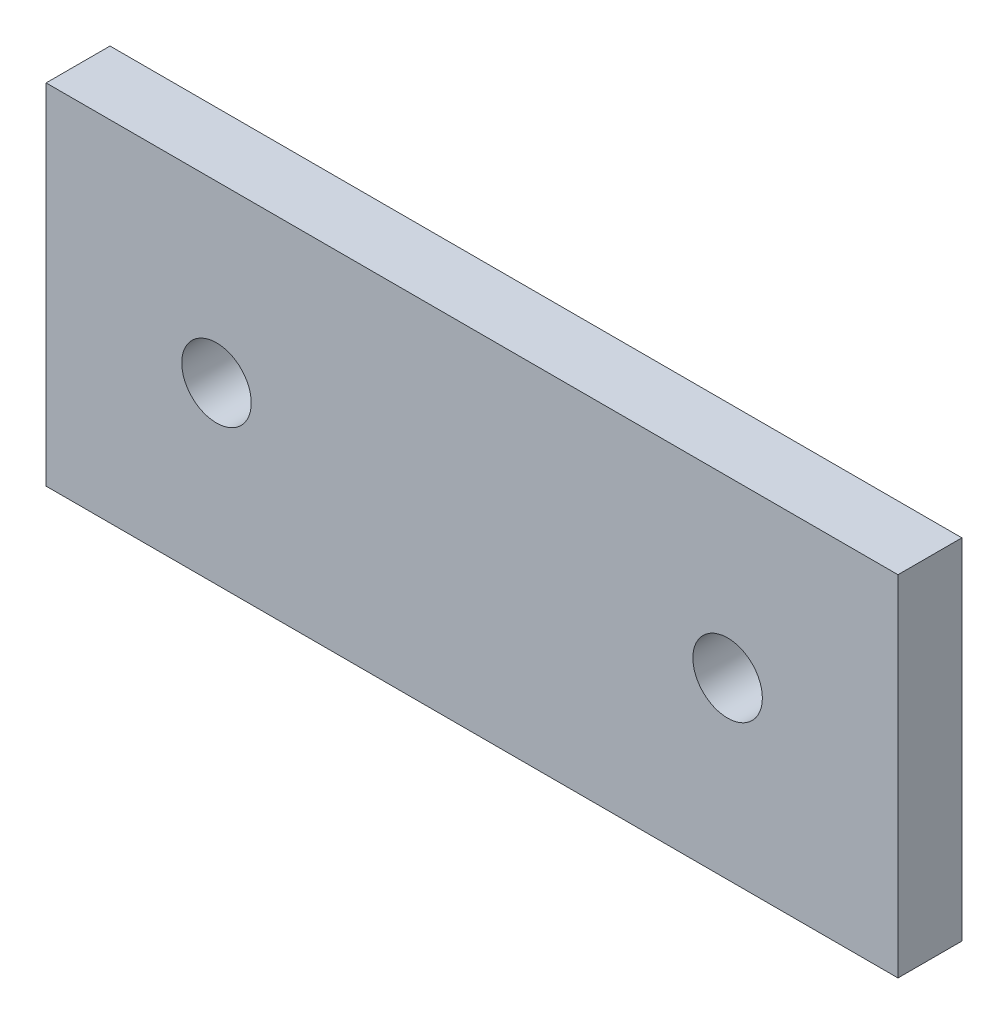
from build123d import *

# Parameters (mm, degrees)
SKETCH1_W                 = 40
SKETCH1_H                 = 16.4
BOSS_EXTRUDE1_DEPTH       = 3
F_4_CLEARANCE_HOLE1_D     = 3.2639
F_4_CLEARANCE_HOLE1_DEPTH = 10
F_4_CLEARANCE_HOLE1_TIP   = 0.980574487


with BuildPart() as part:
    # Sketch1 → Boss-Extrude1 (new body)
    with BuildSketch(Plane.XY):
        Rectangle(SKETCH1_W, SKETCH1_H)
    extrude(amount=-BOSS_EXTRUDE1_DEPTH)

    # #4 Clearance Hole1
    with Locations(Plane.XY):
        with Locations((-12, 0), (12, 0)):
            Hole(F_4_CLEARANCE_HOLE1_D / 2, depth=F_4_CLEARANCE_HOLE1_DEPTH)
            with Locations((0, 0, -(F_4_CLEARANCE_HOLE1_DEPTH + F_4_CLEARANCE_HOLE1_TIP / 2))):  # 118° drill point
                Cone(0, F_4_CLEARANCE_HOLE1_D / 2, F_4_CLEARANCE_HOLE1_TIP, mode=Mode.SUBTRACT)


solid = part.part
